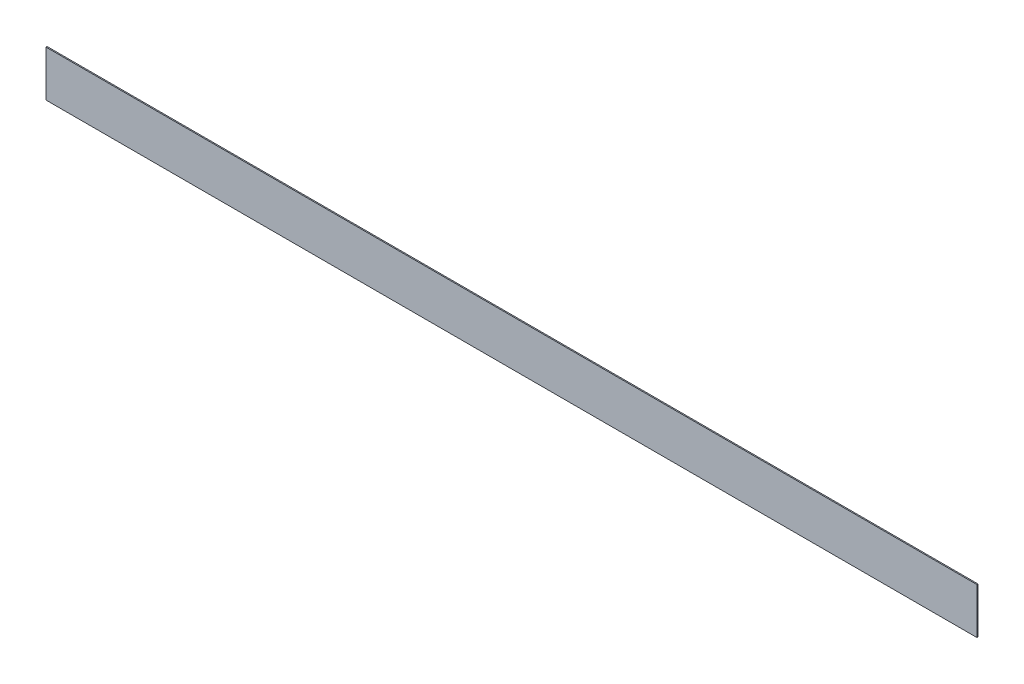
from build123d import *

# Parameters (mm, degrees)
STORE_PANEL_BANT_ALT_1_START = 38.5
SKETCH1_W                    = 1268
SKETCH1_H                    = 62.5
STORE_PANEL_BANT_ALT_1_DEPTH = 1.5


with BuildPart() as part:
    # Sketch1 → STORE_panel_bant_alt_1 (new body)
    with BuildSketch(Plane.XY.offset(STORE_PANEL_BANT_ALT_1_START)):
        with Locations((700, 151.25)):
            Rectangle(SKETCH1_W, SKETCH1_H)
    extrude(amount=STORE_PANEL_BANT_ALT_1_DEPTH)


solid = part.part
